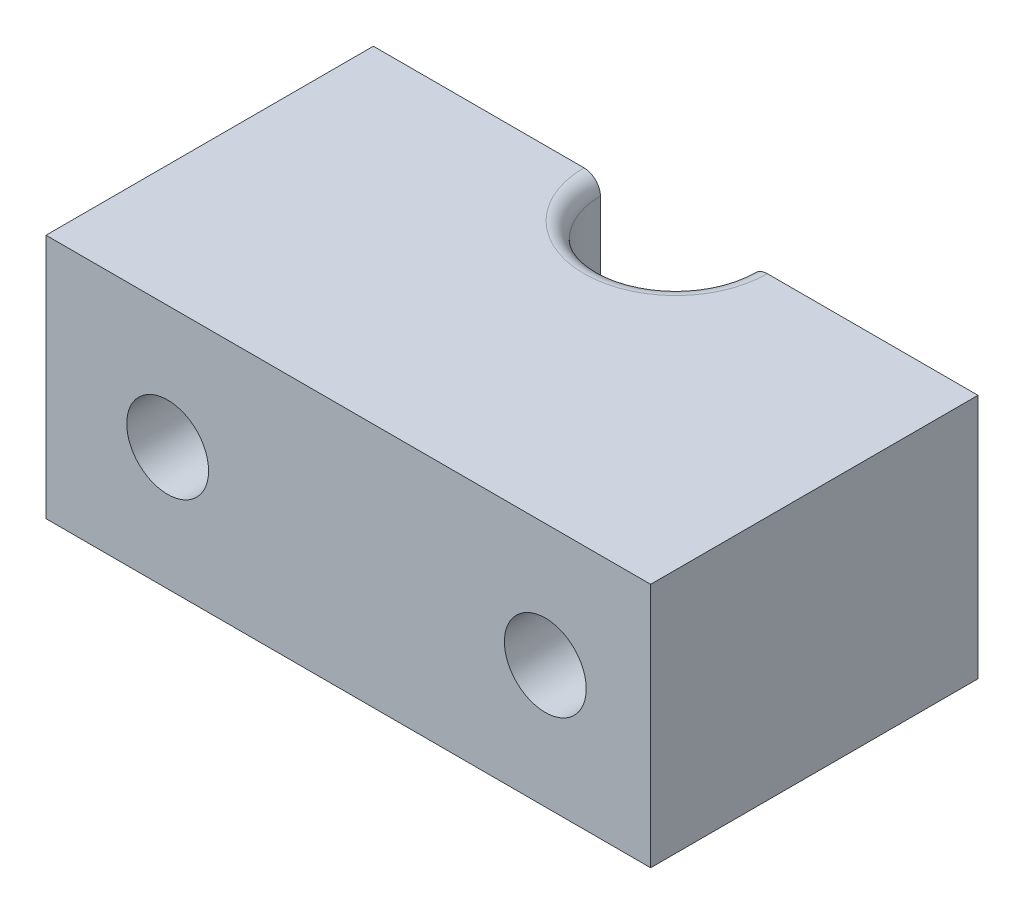
from build123d import *

# Parameters (mm, degrees)
SKETCH_1_W          = 125
SKETCH_1_H          = 40
EXTRUDE_1_DEPTH     = 15
SKETCH_2_R          = 8.9
SKETCH_2_R_2        = 4.6
SKETCH_2_R_3        = 13.3
CUT_EXTRUDE_1_DEPTH = 133.098448136
CHAMFER_1_SIZE      = 1
CHAMFER_2_SIZE      = 1
FILLET_1_R          = 1
SKETCH_5_W          = 40
SKETCH_5_H          = 20
CUT_EXTRUDE_2_DEPTH = 133.098448148
FILLET_4_R          = 5
SKETCH_12_W         = 3.06
SKETCH_12_H         = 20
EXTRUDE_2_DEPTH     = 15
SKETCH_14_R         = 2.5
CUT_EXTRUDE_3_DEPTH = 128.47548784
SKETCH_15_W         = 36.94
SKETCH_15_H         = 20
EXTRUDE_3_DEPTH     = 15
SKETCH_16_W         = 106.425382254
SKETCH_16_H         = 56.336912026
CUT_EXTRUDE_4_DEPTH = 133.098448148
SKETCH_17_R         = 2.5
CUT_EXTRUDE_5_DEPTH = 133.098448136
SKETCH_18_R         = 4.6
CUT_EXTRUDE_6_DEPTH = 133.098448136
FILLET_5_R          = 1
SKETCH_19_W         = 47.376769249
SKETCH_19_H         = 22.00625663
CUT_EXTRUDE_7_DEPTH = 133.098448148
FILLET_6_R          = 1


with BuildPart() as part:
    # 草圖1 → 填料-伸長1 (new body)
    with BuildSketch(Plane(origin=(0, 0, 0), x_dir=(1, 0, 0), z_dir=(0, 1, 0))):
        with Locations((62.5, 20)):
            Rectangle(SKETCH_1_W, SKETCH_1_H)
    extrude(amount=EXTRUDE_1_DEPTH)

    # 草圖2 → 除料-伸長1 (cut, through all)
    with BuildSketch(Plane(origin=(0, 15, 0), x_dir=(1, 0, 0), z_dir=(0, 1, 0))):
        with Locations(Location((18.526668527, 20, 0), (0, 0, 270))):
            Circle(SKETCH_2_R)
        with Locations(Location((106.526668527, 20, 0), (0, 0, 270))):
            Circle(SKETCH_2_R_2)
        with Locations(Location((62.526668527, 20, 0), (0, 0, 270))):
            Circle(SKETCH_2_R_3)
    extrude(amount=-CUT_EXTRUDE_1_DEPTH, mode=Mode.SUBTRACT)

    # 導角1
    chamfer_1_edges = [part.edges().sort_by_distance(p)[0] for p in [
        (18.526668527, 15, -28.9),
    ]]
    chamfer(chamfer_1_edges, length=CHAMFER_1_SIZE)

    # 導角2
    chamfer_2_edges = [part.edges().sort_by_distance(p)[0] for p in [
        (18.526668527, 0, -28.9),
    ]]
    chamfer(chamfer_2_edges, length=CHAMFER_2_SIZE)

    # 圓角1
    fillet_1_edges = [part.edges().sort_by_distance(p)[0] for p in [
        (106.526668527, 0, -24.6),
        (106.526668527, 15, -24.6),
        (62.526668527, 0, -33.3),
        (62.526668527, 15, -33.3),
    ]]
    fillet(fillet_1_edges, radius=FILLET_1_R)

    # 草圖5 → 除料-伸長2 (cut, through all)
    with BuildSketch(Plane(origin=(0, 15, 0), x_dir=(1, 0, 0), z_dir=(0, 1, 0))):
        with Locations((105, 10)):
            Rectangle(SKETCH_5_W, SKETCH_5_H)
    extrude(amount=-CUT_EXTRUDE_2_DEPTH, mode=Mode.SUBTRACT)

    # 圓角4
    fillet_4_edges = [part.edges().sort_by_distance(p)[0] for p in [
        (0, 7.5, -40),
        (0, 7.5, 0),
    ]]
    fillet(fillet_4_edges, radius=FILLET_4_R)

    # 草圖12 → 填料-伸長2 (add)
    with BuildSketch(Plane(origin=(0, 15, 0), x_dir=(1, 0, 0), z_dir=(0, 1, 0))):
        with Locations((86.53, 10)):
            Rectangle(SKETCH_12_W, SKETCH_12_H)
    extrude(amount=-EXTRUDE_2_DEPTH)

    # 草圖14 → 除料-伸長3 (cut, through all)
    with BuildSketch(Plane.XY.offset(-20)):
        with Locations((118.565, 7.5)):
            Circle(SKETCH_14_R)
        with Locations((95.491668527, 7.5)):
            Circle(SKETCH_14_R)
    extrude(amount=-CUT_EXTRUDE_3_DEPTH, mode=Mode.SUBTRACT)

    # 草圖16 → 除料-伸長4 (cut, through all)
    with BuildSketch(Plane(origin=(0, 15, 0), x_dir=(1, 0, 0), z_dir=(0, 1, 0))):
        with Locations((34.847308873, 28.168456013)):
            Rectangle(SKETCH_16_W, SKETCH_16_H)
    extrude(amount=-CUT_EXTRUDE_4_DEPTH, mode=Mode.SUBTRACT)


with BuildPart() as body_2:
    # 草圖15 → 填料-伸長3 (new body)
    with BuildSketch(Plane(origin=(0, 15, 0), x_dir=(1, 0, 0), z_dir=(0, 1, 0))):
        with Locations((106.53, 10)):
            Rectangle(SKETCH_15_W, SKETCH_15_H)
    extrude(amount=-EXTRUDE_3_DEPTH)

    # 草圖17 → 除料-伸長5 (cut, through all)
    with BuildSketch(Plane.XY):
        with Locations((95.491668527, 7.5)):
            Circle(SKETCH_17_R)
        with Locations((118.565, 7.5)):
            Circle(SKETCH_17_R)
    extrude(amount=-CUT_EXTRUDE_5_DEPTH, mode=Mode.SUBTRACT)


with BuildPart() as cut_extrude_6_tool:
    # 草圖18 → 除料-伸長6 (new, through all)
    with BuildSketch(Plane(origin=(0, 15, 0), x_dir=(1, 0, 0), z_dir=(0, 1, 0))):
        with Locations((106.53, 20)):
            Circle(SKETCH_18_R)
    extrude(amount=-CUT_EXTRUDE_6_DEPTH)


with BuildPart() as part_1:
    add(part.part)

    # 除料-伸長6: cut by cut_extrude_6_tool
    add(cut_extrude_6_tool.part, mode=Mode.SUBTRACT)

    # 草圖19 → 除料-伸長7 (cut, through all)
    with BuildSketch(Plane(origin=(0, 15, 0), x_dir=(1, 0, 0), z_dir=(0, 1, 0))):
        with Locations((111.748384625, 31.003128315)):
            Rectangle(SKETCH_19_W, SKETCH_19_H)
    extrude(amount=-CUT_EXTRUDE_7_DEPTH, mode=Mode.SUBTRACT)


with BuildPart() as body_2_1:
    add(body_2.part)

    # 除料-伸長6: cut by cut_extrude_6_tool
    add(cut_extrude_6_tool.part, mode=Mode.SUBTRACT)

    # 圓角5
    fillet_5_edges = [body_2_1.edges().sort_by_distance(p)[0] for p in [
        (106.53, 15, -15.4),
    ]]
    fillet(fillet_5_edges, radius=FILLET_5_R)

    # 圓角6
    fillet_6_edges = [body_2_1.edges().sort_by_distance(p)[0] for p in [
        (106.53, 0, -15.4),
    ]]
    fillet(fillet_6_edges, radius=FILLET_6_R)


solid = body_2_1.part
